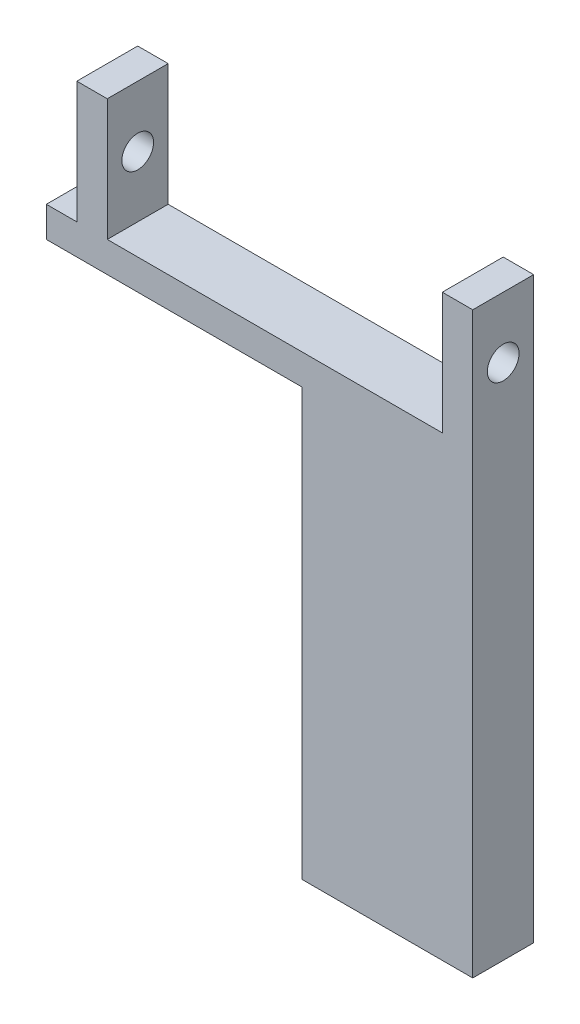
from build123d import *

# Parameters (mm, degrees)
EXTRUDE_1_DEPTH     = 10
SKETCH_3_R          = 2.6
CUT_EXTRUDE_1_DEPTH = 116.542200083


with BuildPart() as part:
    # ｽｹｯﾁ2 → ﾎﾞｽ - 押し出し1 (new body)
    with BuildSketch(Plane.XY):
        Polygon((-60, 75), (-5, 75), (-5, 95), (0, 95), (0, 75), (0, 70), (0, 0), (-28, 0), (-28, 70), (-70, 70), (-70, 75), (-65, 75), (-65, 95), (-60, 95), align=None)
    extrude(amount=EXTRUDE_1_DEPTH)

    # ｽｹｯﾁ3 → ｶｯﾄ - 押し出し1 (cut, through all)
    with BuildSketch(Plane.ZY.offset(65)):
        with Locations((5, 85)):
            Circle(SKETCH_3_R)
    extrude(amount=-CUT_EXTRUDE_1_DEPTH, mode=Mode.SUBTRACT)


solid = part.part
